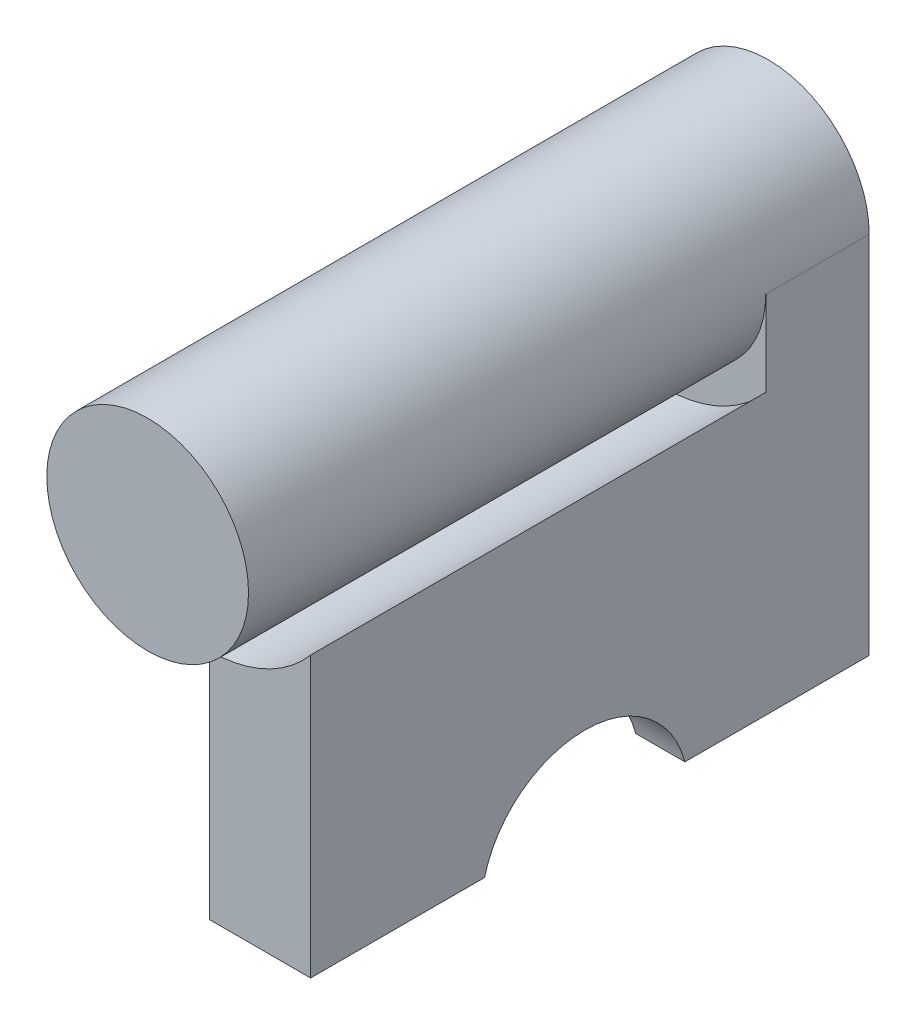
from build123d import *

# Parameters (mm, degrees)
SKETCH_1_R          = 1.95
EXTRUDE_1_DEPTH     = 12
SKETCH_4_W          = 2
SKETCH_4_H          = 9
EXTRUDE_2_DEPTH     = 1.95
EXTRUDE_4_DEPTH     = 8.8
SKETCH_9_R          = 2
CUT_EXTRUDE_2_DEPTH = 17
SKETCH_13_R         = 2.75
CUT_EXTRUDE_6_DEPTH = 1
CUT_EXTRUDE_7_DEPTH = 13.389713


with BuildPart() as part:
    # 스케치1 → 보스-돌출1 (new body)
    with BuildSketch(Plane.XY):
        Circle(SKETCH_1_R)
    extrude(amount=EXTRUDE_1_DEPTH)

    # 스케치4 → 보스-돌출2 (add)
    with BuildSketch(Plane(origin=(0, 0, 0), x_dir=(0, 0, -1), z_dir=(1, 0, 0))):
        with Locations((-1, -2.55)):
            Rectangle(SKETCH_4_W, SKETCH_4_H)
    extrude(amount=EXTRUDE_2_DEPTH)

    # 스케치8 → 보스-돌출4 (add)
    with BuildSketch(Plane.XY.offset(2)):
        with BuildLine():
            ThreePointArc((1.95, -1.643168), (1.075273, -2.312204), (0, -2.55))
            Line((0, -2.55), (0, -7.05))
            Line((0, -7.05), (1.95, -7.05))
            Line((1.95, -7.05), (1.95, -1.643168))
        make_face()
    extrude(amount=EXTRUDE_4_DEPTH)

    # 스케치9 → 컷-돌출2 (cut)
    with BuildSketch(Plane.ZY):
        with Locations((5.5, -7.55)):
            Circle(SKETCH_9_R)
    extrude(amount=-CUT_EXTRUDE_2_DEPTH, mode=Mode.SUBTRACT)

    # 스케치13 → 컷-돌출6 (cut)
    with BuildSketch(Plane.ZY):
        with Locations((5.505014, -7.55)):
            Circle(SKETCH_13_R)
    extrude(amount=-CUT_EXTRUDE_6_DEPTH, mode=Mode.SUBTRACT)

    # 스케치12 → 컷-돌출7 (cut, through all)
    with BuildSketch(Plane.XY.offset(2)):
        with BuildLine():
            Line((1.95, 0), (1.95, 1.95))
            Line((1.95, 1.95), (0, 1.95))
            ThreePointArc((0, 1.95), (1.378858, 1.378858), (1.95, 0))
        make_face()
    extrude(amount=-CUT_EXTRUDE_7_DEPTH, mode=Mode.SUBTRACT)


solid = part.part
